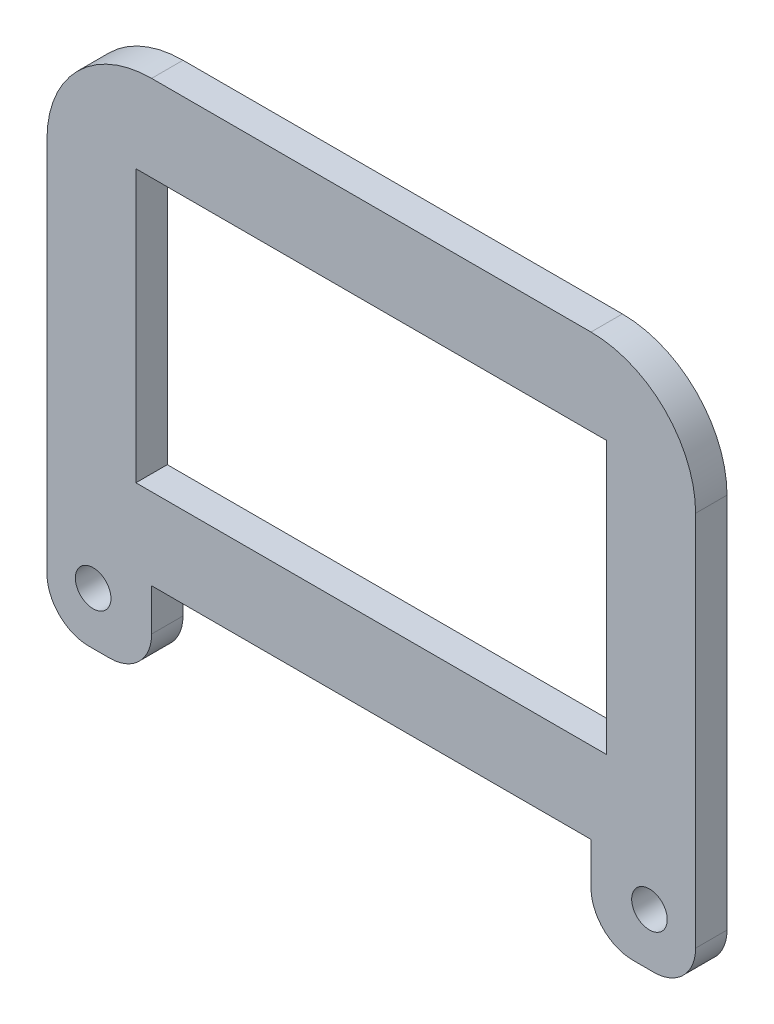
from build123d import *

# Parameters (mm, degrees)
SCHIZZO2_W                   = 62
SCHIZZO2_H                   = 50
ESTRUSIONE_ESTRUSIONE1_DEPTH = 3
FORO_PER_VITE_M3_1_D         = 3.4
SCHIZZO5_W                   = 42
SCHIZZO5_H                   = 8
TAGLIO_ESTRUSIONE1_DEPTH     = 3
SCHIZZO6_W                   = 45
SCHIZZO6_H                   = 26
TAGLIO_ESTRUSIONE2_DEPTH     = 3
RACCORDO1_R                  = 10
RACCORDO2_R                  = 4


with BuildPart() as part:
    # Schizzo2 → Estrusione-Estrusione1 (new body)
    with BuildSketch(Plane.XY):
        Rectangle(SCHIZZO2_W, SCHIZZO2_H)
    extrude(amount=ESTRUSIONE_ESTRUSIONE1_DEPTH)

    # Foro per Vite M3-1 (through all)
    with Locations(Plane.XY.offset(3)):
        with Locations((-26.586432577, -20), (26.586432577, -20)):
            Hole(FORO_PER_VITE_M3_1_D / 2)

    # Schizzo5 → Taglio-Estrusione1 (cut)
    with BuildSketch(Plane.XY.offset(3)):
        with Locations((0, -21)):
            Rectangle(SCHIZZO5_W, SCHIZZO5_H)
    extrude(amount=-TAGLIO_ESTRUSIONE1_DEPTH, mode=Mode.SUBTRACT)

    # Schizzo6 → Taglio-Estrusione2 (cut)
    with BuildSketch(Plane.XY.offset(3)):
        with Locations((0, 3.772071737)):
            Rectangle(SCHIZZO6_W, SCHIZZO6_H)
    extrude(amount=-TAGLIO_ESTRUSIONE2_DEPTH, mode=Mode.SUBTRACT)

    # Raccordo1
    raccordo1_edges = [part.edges().sort_by_distance(p)[0] for p in [
        (-31, 25, 1.5),
        (31, 25, 1.5),
    ]]
    fillet(raccordo1_edges, radius=RACCORDO1_R)

    # Raccordo2
    raccordo2_edges = [part.edges().sort_by_distance(p)[0] for p in [
        (-21, -25, 1.5),
        (21, -25, 1.5),
        (31, -25, 1.5),
        (-31, -25, 1.5),
    ]]
    fillet(raccordo2_edges, radius=RACCORDO2_R)


solid = part.part
